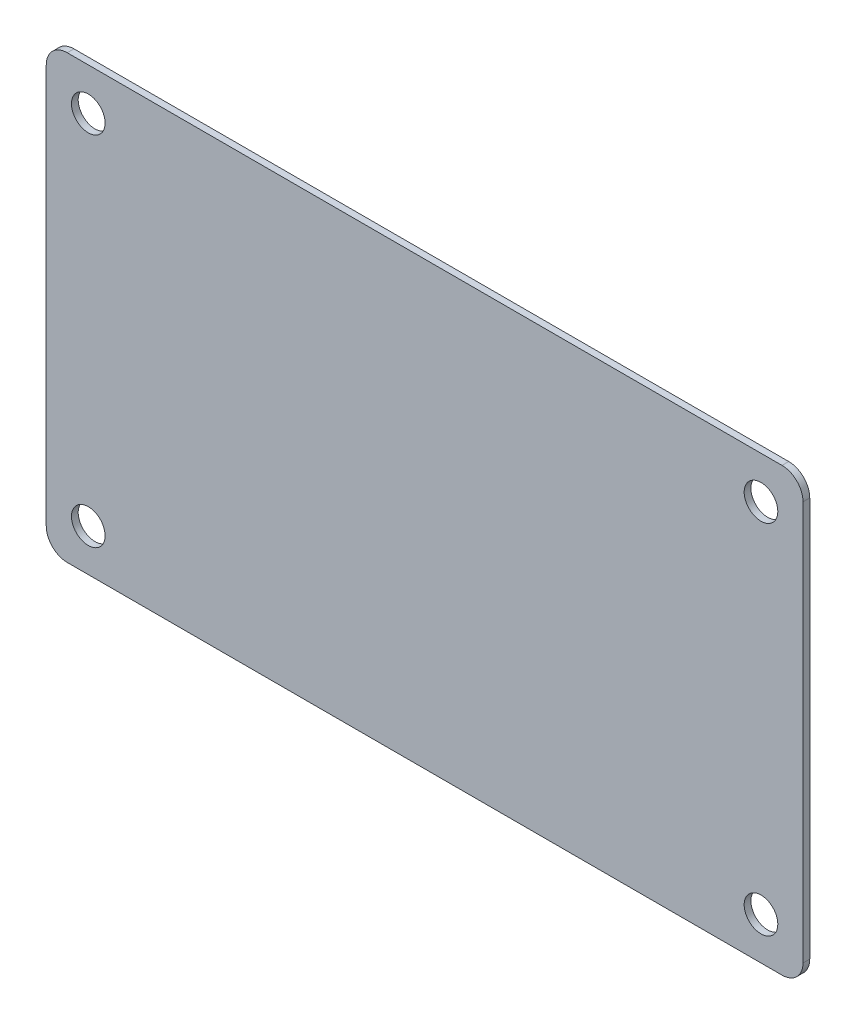
from build123d import *

# Parameters (mm, degrees)
EXTRUDE_1_DEPTH          = 1.6
CUT_EXTRUDE_1_DEPTH      = 209.392802179
CUT_EXTRUDE_1_DEPTH_BACK = 209.392802179
SKETCH_2_R               = 4


with BuildPart() as part:
    # ｽｹｯﾁ1 → ﾎﾞｽ - 押し出し1 (new body)
    with BuildSketch(Plane.XY):
        with BuildLine():
            Line((5, 0), (175, 0))
            ThreePointArc((175, 0), (178.535533906, 1.464466094), (180, 5))
            Line((180, 5), (180, 100))
            ThreePointArc((180, 100), (178.535533906, 103.535533906), (175, 105))
            Line((175, 105), (5, 105))
            ThreePointArc((5, 105), (1.464466094, 103.535533906), (0, 100))
            Line((0, 100), (0, 5))
            ThreePointArc((0, 5), (1.464466094, 1.464466094), (5, 0))
        make_face()
    extrude(amount=EXTRUDE_1_DEPTH)

    # ｽｹｯﾁ2 → ｶｯﾄ - 押し出し1 (cut, two sides: drawn at the far end of the back side and taken through both)
    with BuildSketch(Plane.XY.offset(-CUT_EXTRUDE_1_DEPTH_BACK)):
        with Locations((10, 10)):
            Circle(SKETCH_2_R)
        with Locations((10, 95)):
            Circle(SKETCH_2_R)
        with Locations((170, 10)):
            Circle(SKETCH_2_R)
        with Locations((170, 95)):
            Circle(SKETCH_2_R)
    extrude(amount=CUT_EXTRUDE_1_DEPTH + CUT_EXTRUDE_1_DEPTH_BACK, mode=Mode.SUBTRACT)


solid = part.part
